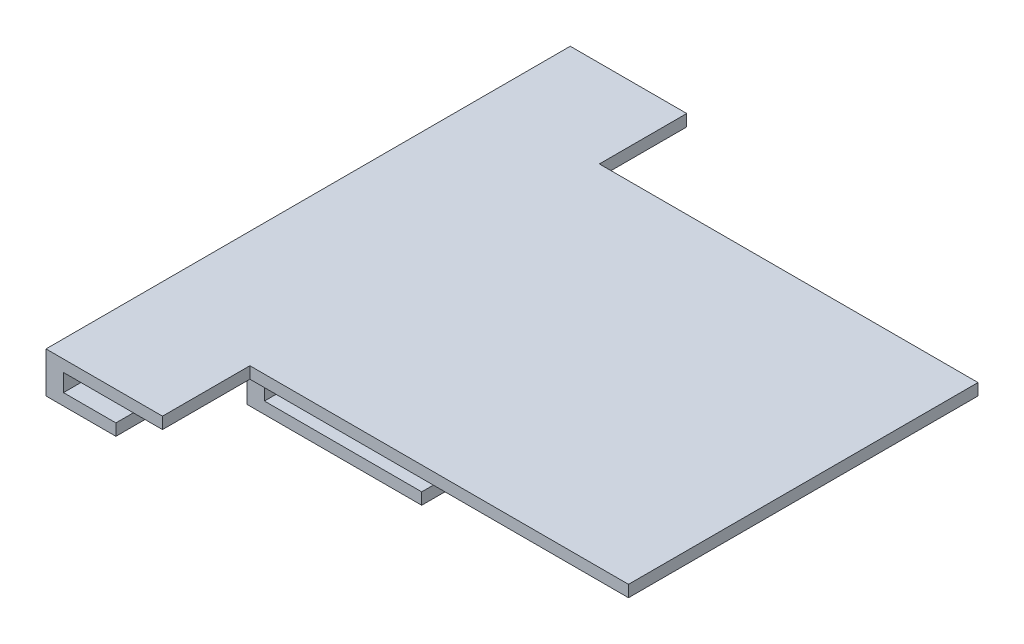
from build123d import *

# Parameters (mm, degrees)
BOSS_EXTRUDE1_DEPTH = 2
SKETCH2_W           = 3
SKETCH2_H           = 58
BOSS_EXTRUDE2_DEPTH = 3
SKETCH3_W           = 12
SKETCH3_H           = 15.5
SKETCH3_W_2         = 30
SKETCH3_H_2         = 58
BOSS_EXTRUDE3_DEPTH = 2


with BuildPart() as part:
    # Sketch1 → Boss-Extrude1 (new body)
    with BuildSketch(Plane(origin=(0, 0, 0), x_dir=(1, 0, 0), z_dir=(0, 1, 0))):
        Polygon((-22.5, 30), (42.5, 30), (42.5, -30), (-22.5, -30), (-22.5, -45), (-42.5, -45), (-42.5, -30), (-42.5, 30), (-42.5, 45), (-22.5, 45), align=None)
    extrude(amount=BOSS_EXTRUDE1_DEPTH)

    # Sketch2 → Boss-Extrude2 (add)
    with BuildSketch(Plane.XZ):
        Polygon((-42.5, -45), (-39.5, -45), (-39.5, -32.5), (-30.5, -32.5), (-30.5, -29.5), (-40.524301108, -29.5), (-42.5, -29.5), align=None)
        with Locations((-22.5, 0)):
            Rectangle(SKETCH2_W, SKETCH2_H)
        Polygon((-42.5, 45), (-39.5, 45), (-39.5, 32.5), (-30.5, 32.5), (-30.5, 29.5), (-40.524301108, 29.5), (-42.5, 29.5), align=None)
    extrude(amount=BOSS_EXTRUDE2_DEPTH)

    # Sketch3 → Boss-Extrude3 (add)
    with BuildSketch(Plane.XZ.offset(3)):
        with Locations((-36.5, 37.25)):
            Rectangle(SKETCH3_W, SKETCH3_H)
        with Locations((-36.5, -37.25)):
            Rectangle(SKETCH3_W, SKETCH3_H)
        with Locations((-9, 0)):
            Rectangle(SKETCH3_W_2, SKETCH3_H_2)
    extrude(amount=BOSS_EXTRUDE3_DEPTH)


solid = part.part
